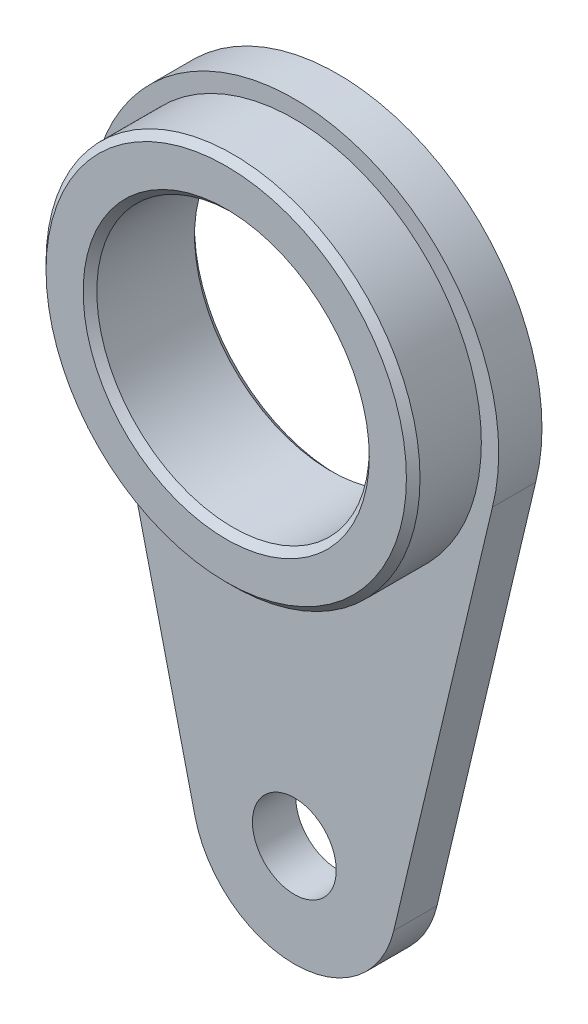
from build123d import *

# Parameters (mm, degrees)
CROQUIS1_R                          = 25
CROQUIS1_R_2                        = 6.15
SALIENTE_EXTRUIR1_DEPTH             = 6.35
CROQUIS2_R                          = 27.45
CROQUIS2_R_2                        = 20
SALIENTE_EXTRUIR2_DEPTH             = 10
SALIENTE_EXTRUIR2_DIRECTION_2_REACH = 87.676
CHAFL_N1_SIZE                       = 1


with BuildPart() as part:
    # Croquis1 → Saliente-Extruir1 (new body)
    with BuildSketch(Plane.XY):
        with BuildLine():
            Line((14.595331362, -68.460679477), (29.078013405, -7.380320889))
            ThreePointArc((29.078013405, -7.380320889), (0, 30), (-29.078013405, -7.380320889))
            Line((-29.078013405, -7.380320889), (-14.595331362, -68.460679477))
            ThreePointArc((-14.595331362, -68.460679477), (0, -80), (14.595331362, -68.460679477))
        make_face()
        Circle(CROQUIS1_R, mode=Mode.SUBTRACT)
        with Locations((0, -65)):
            Circle(CROQUIS1_R_2, mode=Mode.SUBTRACT)
    extrude(amount=SALIENTE_EXTRUIR1_DEPTH)

    # Croquis2 → Saliente-Extruir2 (add)
    with BuildSketch(Plane.XY.offset(6.35)):
        Circle(CROQUIS2_R)
        Circle(CROQUIS2_R_2, mode=Mode.SUBTRACT)
    extrude(amount=SALIENTE_EXTRUIR2_DEPTH)

    # Saliente-Extruir2 direction 2: up to this face of the body (flat: up to its plane)
    saliente_extruir2_direction_2_end = Plane(part.part.faces().sort_by_distance((0, -32.142670277, 0))[0])
    # Croquis2 → Saliente-Extruir2 direction 2 (add, up to the picked face)
    with BuildSketch(Plane.XY.offset(6.35), mode=Mode.PRIVATE) as saliente_extruir2_direction_2_sk1:
        Circle(CROQUIS2_R)
        Circle(CROQUIS2_R_2, mode=Mode.SUBTRACT)
    saliente_extruir2_direction_2_tool1 = split(extrude(saliente_extruir2_direction_2_sk1.sketch, amount=-SALIENTE_EXTRUIR2_DIRECTION_2_REACH, mode=Mode.PRIVATE), bisect_by=saliente_extruir2_direction_2_end, keep=Keep.BOTH, mode=Mode.PRIVATE)
    add(saliente_extruir2_direction_2_tool1.solids().sort_by(Axis((-26.673597, 0, 6.35), (0, 0, -1)))[0])

    # Chaflán1
    chafl_n1_edges = [part.edges().sort_by_distance(p)[0] for p in [
        (-20, 0, 0),
        (-20, 0, 16.35),
        (-27.45, 0, 16.35),
    ]]
    chamfer(chafl_n1_edges, length=CHAFL_N1_SIZE)


solid = part.part
